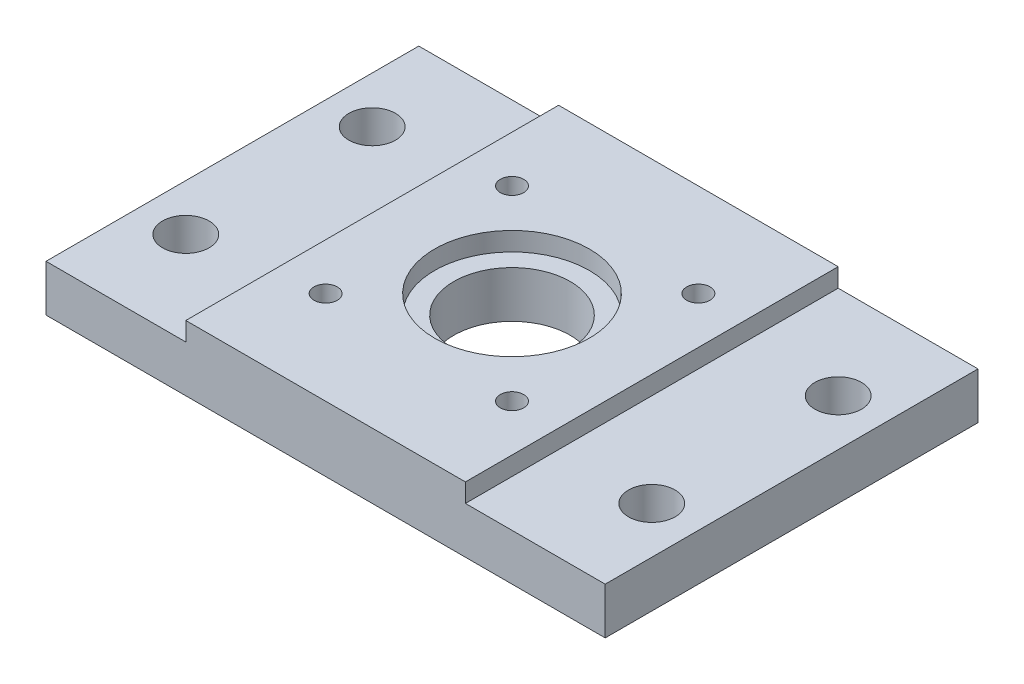
from build123d import *

# Parameters (mm, degrees)
SKETCH1_W            = 60
SKETCH1_H            = 40
SKETCH1_R            = 2.5
SKETCH1_R_2          = 6.25
BODY_DEPTH           = 5
SKETCH3_W            = 30
SKETCH3_H            = 40
SKETCH3_R            = 8.3
BEARING_PLACE_DEPTH  = 2
SKETCH4_R            = 1.25
FIXATION_HOLES_DEPTH = 37.728735344


with BuildPart() as part:
    # Sketch1 → Body (new body)
    with BuildSketch(Plane(origin=(0, 0, 0), x_dir=(1, 0, 0), z_dir=(0, 1, 0))):
        Rectangle(SKETCH1_W, SKETCH1_H)
        with Locations(Location((25, 10, 0), (0, 0, 270))):
            Circle(SKETCH1_R, mode=Mode.SUBTRACT)
        with Locations(Location((25, -10, 0), (0, 0, 270))):
            Circle(SKETCH1_R, mode=Mode.SUBTRACT)
        with Locations(Location((0, 0, 0), (0, 0, 270))):
            Circle(SKETCH1_R_2, mode=Mode.SUBTRACT)
        with Locations(Location((-25, -10, 0), (0, 0, 90))):
            Circle(SKETCH1_R, mode=Mode.SUBTRACT)
        with Locations(Location((-25, 10, 0), (0, 0, 90))):
            Circle(SKETCH1_R, mode=Mode.SUBTRACT)
    extrude(amount=BODY_DEPTH)

    # Sketch3 → Bearing_Place (add)
    with BuildSketch(Plane(origin=(0, 5, 0), x_dir=(1, 0, 0), z_dir=(0, 1, 0))):
        Rectangle(SKETCH3_W, SKETCH3_H)
        with Locations(Location((0, 0, 0), (0, 0, 270))):
            Circle(SKETCH3_R, mode=Mode.SUBTRACT)
    extrude(amount=BEARING_PLACE_DEPTH)

    # Sketch4 → Fixation_Holes (cut, through all)
    with BuildSketch(Plane(origin=(0, 7, 0), x_dir=(1, 0, 0), z_dir=(0, 1, 0))):
        with Locations(Location((-10, 10, 0), (0, 0, 270))):
            Circle(SKETCH4_R)
        with Locations(Location((10, 10, 0), (0, 0, 270))):
            Circle(SKETCH4_R)
        with Locations(Location((10, -10, 0), (0, 0, 270))):
            Circle(SKETCH4_R)
        with Locations(Location((-10, -10, 0), (0, 0, 270))):
            Circle(SKETCH4_R)
    extrude(amount=-FIXATION_HOLES_DEPTH, mode=Mode.SUBTRACT)


solid = part.part
